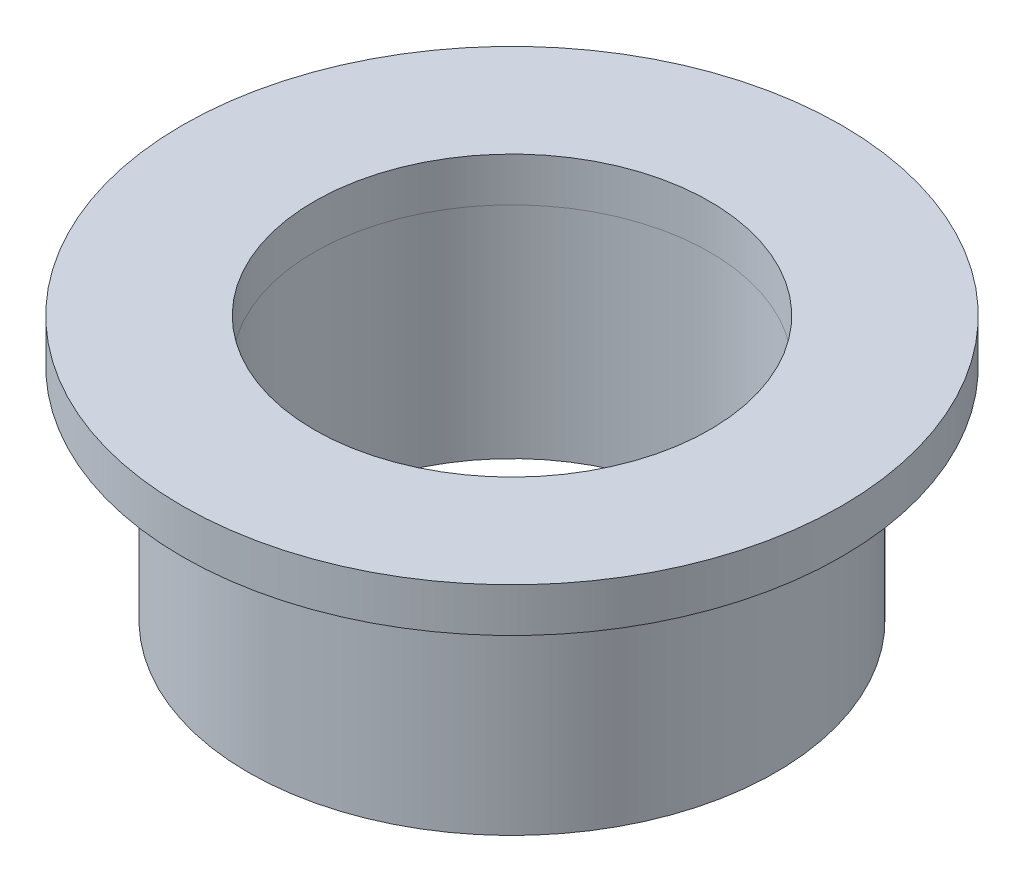
from build123d import *

# Parameters (mm, degrees)
SKETCH1_R           = 7.5
SKETCH1_R_2         = 4.5
BOSS_EXTRUDE1_DEPTH = 1
SKETCH1_3_R         = 6
SKETCH1_3_R_2       = 4.5
BOSS_EXTRUDE2_DEPTH = 5


with BuildPart() as part:
    # Sketch1 → Boss-Extrude1 (new body)
    with BuildSketch(Plane(origin=(0, 0, 0), x_dir=(1, 0, 0), z_dir=(0, 1, 0))):
        Circle(SKETCH1_R)
        Circle(SKETCH1_R_2, mode=Mode.SUBTRACT)
    extrude(amount=BOSS_EXTRUDE1_DEPTH)


with BuildPart() as body_2:
    # Sketch1<3> → Boss-Extrude2 (new body)
    with BuildSketch(Plane(origin=(0, 0, 0), x_dir=(1, 0, 0), z_dir=(0, 1, 0))):
        Circle(SKETCH1_3_R)
        Circle(SKETCH1_3_R_2, mode=Mode.SUBTRACT)
    extrude(amount=-BOSS_EXTRUDE2_DEPTH)


solid = Compound([part.part, body_2.part])
